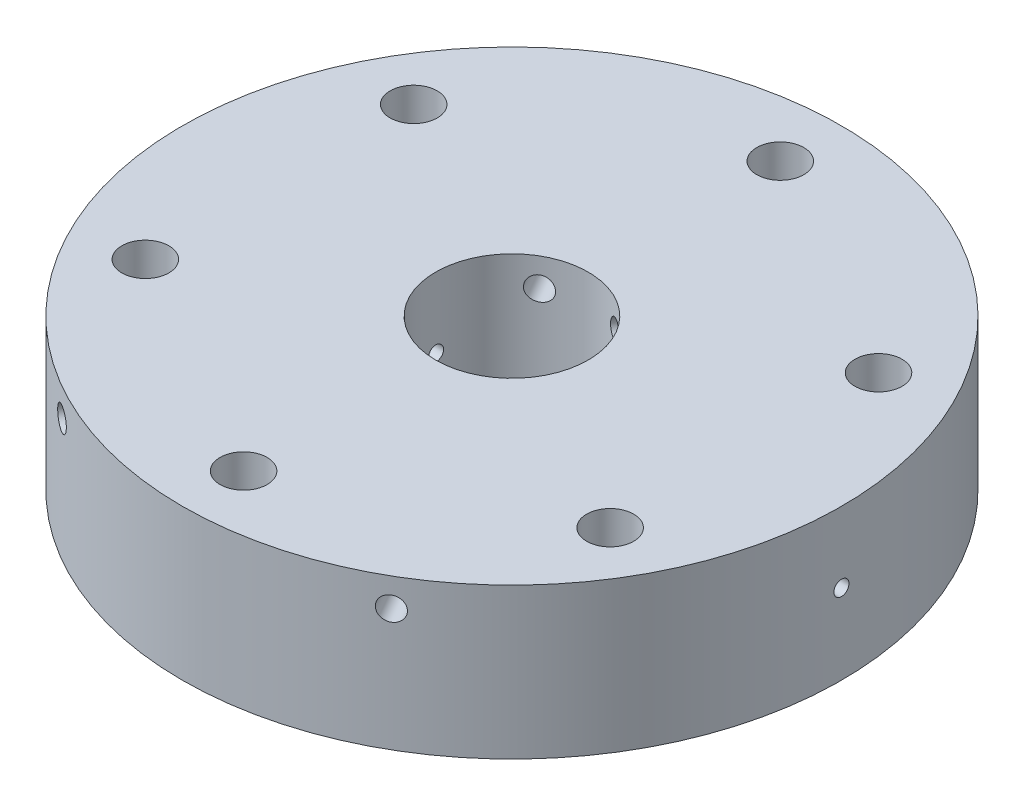
from build123d import *

# Parameters (mm, degrees)
SKETCH1_R                            = 88.9
BOSS_EXTRUDE1_DEPTH                  = 40.64
SKETCH2_R                            = 20.574
CUT_EXTRUDE1_DEPTH                   = 133.128837125
CUT_EXTRUDE4_DEPTH                   = 133.128837125
CUT_EXTRUDE4_DEPTH_BACK              = 133.128837125
SKETCH3_R                            = 2.032
SKETCH6_R                            = 3.175
CUT_EXTRUDE5_DEPTH                   = 133.128837297
F_1_2_0_5_DIAMETER_HOLE1_D           = 12.7
F_1_2_0_5_DIAMETER_HOLE1_CSINK_D     = 13.97
F_1_2_0_5_DIAMETER_HOLE1_CSINK_ANGLE = 90
CIRPATTERN1_COUNT                    = 6
SKETCH9_W                            = 10.16
SKETCH9_H                            = 5.08


with BuildPart() as part:
    # Sketch1 → Boss-Extrude1 (new body)
    with BuildSketch(Plane(origin=(0, 0, 0), x_dir=(1, 0, 0), z_dir=(0, 1, 0))):
        with Locations(Location((0, 0, 0), (0, 0, 270))):
            Circle(SKETCH1_R)
    extrude(amount=BOSS_EXTRUDE1_DEPTH)

    # Sketch2 → Cut-Extrude1 (cut, through all)
    with BuildSketch(Plane(origin=(0, 40.64, 0), x_dir=(1, 0, 0), z_dir=(0, 1, 0))):
        with Locations(Location((0, 0, 0), (0, 0, 270))):
            Circle(SKETCH2_R)
    extrude(amount=-CUT_EXTRUDE1_DEPTH, mode=Mode.SUBTRACT)

    # Sketch3 → Cut-Extrude4 (cut, two sides: drawn at the far end of the back side and taken through both)
    with BuildSketch(Plane(origin=(0, 0, 0), x_dir=(0, 0, -1), z_dir=(1, 0, 0)).offset(-CUT_EXTRUDE4_DEPTH_BACK)):
        with Locations((0, 21.59)):
            Circle(SKETCH3_R)
    extrude(amount=CUT_EXTRUDE4_DEPTH + CUT_EXTRUDE4_DEPTH_BACK, mode=Mode.SUBTRACT)

    # Sketch6 → Cut-Extrude5 (cut, symmetric)
    with BuildSketch(Plane(origin=(0, 0, 0), x_dir=(0, 1, 0), z_dir=(0.499999999999998, 0, -0.8660254037844398))):
        with Locations(Location((33.02, 0, 0), (0, 0, 270))):
            Circle(SKETCH6_R)
    cut_extrude5 = extrude(amount=CUT_EXTRUDE5_DEPTH, both=True, mode=Mode.SUBTRACT)

    # Mirror1: Cut-Extrude5 across plane
    add(cut_extrude5.mirror(Plane.XY), mode=Mode.SUBTRACT)

    # 1/2 (0.5) Diameter Hole1 (through all)
    with Locations(Plane(origin=(0, 0, 72.39), x_dir=(0, 0, -1), z_dir=(0, -1, 0))):
        with Locations((0, 0)):
            f_1_2_0_5_diameter_hole1 = CounterSinkHole(F_1_2_0_5_DIAMETER_HOLE1_D / 2, F_1_2_0_5_DIAMETER_HOLE1_CSINK_D / 2, counter_sink_angle=F_1_2_0_5_DIAMETER_HOLE1_CSINK_ANGLE)

    # CirPattern1: 1/2 (0.5) Diameter Hole1 ×6 about axis
    cirpattern1_axis = Axis((0, 0, 0), (0, 1, 0))
    for i in range(1, CIRPATTERN1_COUNT):
        add(f_1_2_0_5_diameter_hole1.rotate(cirpattern1_axis, i * 360 / CIRPATTERN1_COUNT), mode=Mode.SUBTRACT)

    # Sketch9 → Cut-Revolve1 (revolve, cut)
    with BuildSketch(Plane.XY, mode=Mode.PRIVATE) as cut_revolve1_sk:
        with Locations((50.8, 2.54)):
            Rectangle(SKETCH9_W, SKETCH9_H)
    revolve(cut_revolve1_sk.sketch.rotate(Axis((0, 40.64, 0), (0, -1, 0)), 90), axis=Axis((0, 40.64, 0), (0, -1, 0)), mode=Mode.SUBTRACT)


solid = part.part
